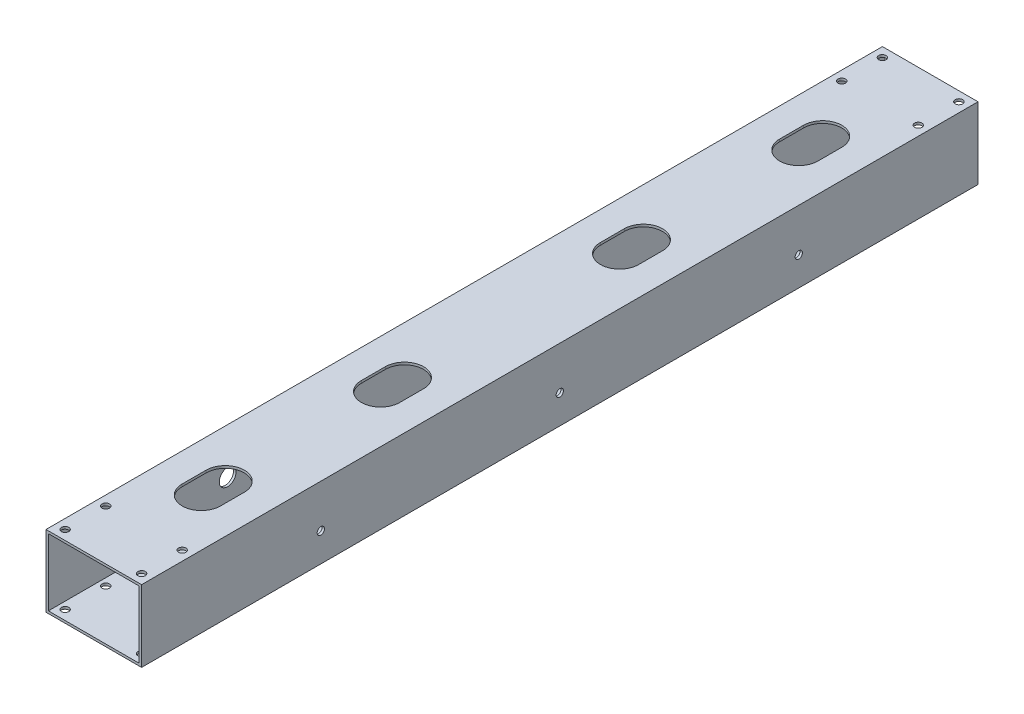
from build123d import *

# Parameters (mm, degrees)
SKETCH_1_W          = 40
SKETCH_1_H          = 30
SKETCH_1_W_2        = 38
SKETCH_1_H_2        = 28
EXTRUDE_1_DEPTH     = 175
SKETCH_2_R          = 1.525
CUT_EXTRUDE_1_DEPTH = 10
SKETCH_3_R          = 3.5
CUT_EXTRUDE_2_DEPTH = 10
SKETCH_5_R          = 1.525
CUT_EXTRUDE_3_DEPTH = 10
CUT_EXTRUDE_4_DEPTH = 80
SKETCH_7_R          = 1.55
CUT_EXTRUDE_5_DEPTH = 80


with BuildPart() as part:
    # 草图1 → 凸台-拉伸1 (new, symmetric)
    with BuildSketch(Plane.XY):
        Rectangle(SKETCH_1_W, SKETCH_1_H)
        Rectangle(SKETCH_1_W_2, SKETCH_1_H_2, mode=Mode.SUBTRACT)
    extrude(amount=EXTRUDE_1_DEPTH, both=True)

    # 草图2 → 切除-拉伸1 (cut)
    with BuildSketch(Plane(origin=(20, 0, 0), x_dir=(0, 0, -1), z_dir=(1, 0, 0))):
        with Locations((0, -3)):
            Circle(SKETCH_2_R)
        with Locations((-100, -3)):
            Circle(SKETCH_2_R)
        with Locations(Location((100, -3, 0), (0, 0, 270))):
            Circle(SKETCH_2_R)
    extrude(amount=-CUT_EXTRUDE_1_DEPTH, mode=Mode.SUBTRACT)

    # 草图3 → 切除-拉伸2 (cut)
    with BuildSketch(Plane(origin=(-19, 0, 0), x_dir=(0, 0, -1), z_dir=(1, 0, 0))):
        with Locations((-100, -3)):
            Circle(SKETCH_3_R)
        with Locations((0, -3)):
            Circle(SKETCH_3_R)
        with Locations((100, -3)):
            Circle(SKETCH_3_R)
    extrude(amount=-CUT_EXTRUDE_2_DEPTH, mode=Mode.SUBTRACT)

    # 草图5 → 切除-拉伸3 (cut)
    with BuildSketch(Plane.ZY.offset(20)):
        with Locations((125, -3)):
            Circle(SKETCH_5_R)
        with Locations((-125, -3)):
            Circle(SKETCH_5_R)
        with Locations((-50, -3)):
            Circle(SKETCH_5_R)
        with Locations((50, -3)):
            Circle(SKETCH_5_R)
    extrude(amount=-CUT_EXTRUDE_3_DEPTH, mode=Mode.SUBTRACT)

    # 草图6 → 切除-拉伸4 (cut)
    with BuildSketch(Plane.XZ.offset(15)):
        with BuildLine():
            Line((-8, 120), (-8, 130))
            ThreePointArc((-8, 130), (0, 138), (8, 130))
            Line((8, 130), (8, 120))
            ThreePointArc((8, 120), (0, 112), (-8, 120))
        make_face()
        with BuildLine():
            Line((-8, 45), (-8, 55))
            ThreePointArc((-8, 55), (0, 63), (8, 55))
            Line((8, 55), (8, 45))
            ThreePointArc((8, 45), (0, 37), (-8, 45))
        make_face()
    cut_extrude_4 = extrude(amount=-CUT_EXTRUDE_4_DEPTH, mode=Mode.SUBTRACT)

    # 镜向1: 切除-拉伸4 across plane
    add(cut_extrude_4.mirror(Plane.XY), mode=Mode.SUBTRACT)

    # 草图7 → 切除-拉伸5 (cut)
    with BuildSketch(Plane(origin=(0, 15, 0), x_dir=(1, 0, 0), z_dir=(0, 1, 0))):
        with Locations(Location((16, 171, 0), (0, 0, 180))):
            Circle(SKETCH_7_R)
        with Locations(Location((16, 154, 0), (0, 0, 180))):
            Circle(SKETCH_7_R)
        with Locations(Location((-16, 154, 0), (0, 0, 180))):
            Circle(SKETCH_7_R)
        with Locations(Location((-16, 171, 0), (0, 0, 180))):
            Circle(SKETCH_7_R)
    cut_extrude_5 = extrude(amount=-CUT_EXTRUDE_5_DEPTH, mode=Mode.SUBTRACT)

    # 镜向2: 切除-拉伸5 across plane
    add(cut_extrude_5.mirror(Plane.XY), mode=Mode.SUBTRACT)


solid = part.part
